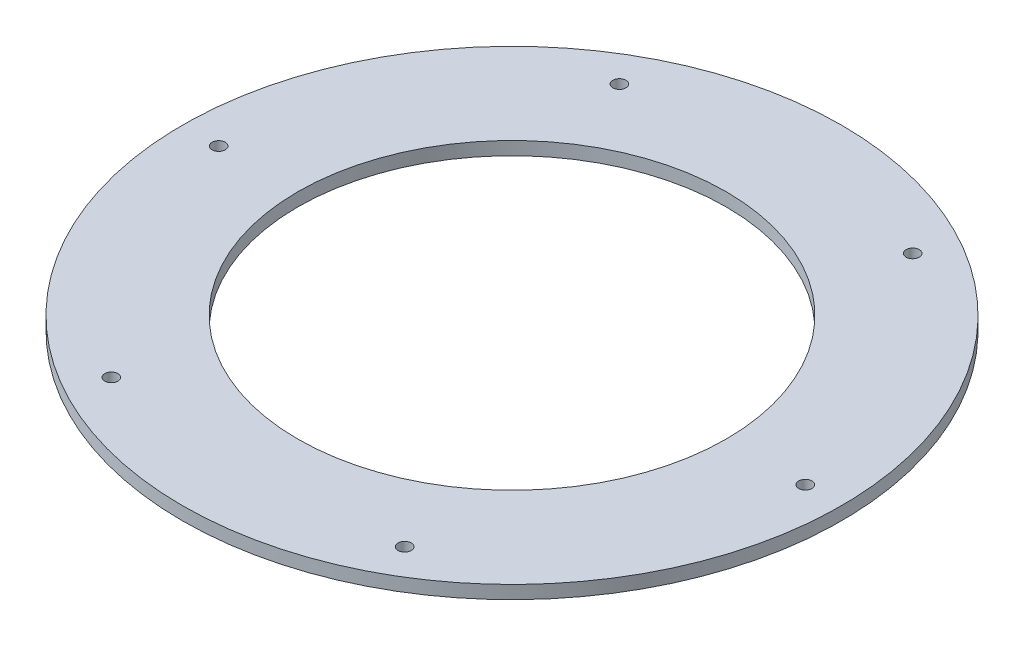
from build123d import *

# Parameters (mm, degrees)
SKETCH1_R           = 250
SKETCH1_R_2         = 162.5
BOSS_EXTRUDE1_DEPTH = 5
SKETCH2_R           = 5
CUT_EXTRUDE1_DEPTH  = 354.694783677


with BuildPart() as part:
    # Sketch1 → Boss-Extrude1 (new, symmetric)
    with BuildSketch(Plane(origin=(0, 0, 0), x_dir=(1, 0, 0), z_dir=(0, 1, 0))):
        with Locations(Location((0, 0, 0), (0, 0, 270))):
            Circle(SKETCH1_R)
        with Locations(Location((0, 0, 0), (0, 0, 270))):
            Circle(SKETCH1_R_2, mode=Mode.SUBTRACT)
    extrude(amount=BOSS_EXTRUDE1_DEPTH, both=True)

    # Sketch2 → Cut-Extrude1 (cut, through all)
    with BuildSketch(Plane(origin=(0, 5, 0), x_dir=(1, 0, 0), z_dir=(0, 1, 0))):
        with Locations(Location((111.25, 192.690652342, 0), (0, 0, 270))):
            Circle(SKETCH2_R)
        with Locations(Location((222.5, 0, 0), (0, 0, 270))):
            Circle(SKETCH2_R)
        with Locations(Location((-111.25, 192.690652342, 0), (0, 0, 90))):
            Circle(SKETCH2_R)
        with Locations(Location((-222.5, 0, 0), (0, 0, 90))):
            Circle(SKETCH2_R)
        with Locations(Location((111.25, -192.690652342, 0), (0, 0, 90))):
            Circle(SKETCH2_R)
        with Locations(Location((-111.25, -192.690652342, 0), (0, 0, 270))):
            Circle(SKETCH2_R)
    extrude(amount=-CUT_EXTRUDE1_DEPTH, mode=Mode.SUBTRACT)


solid = part.part
